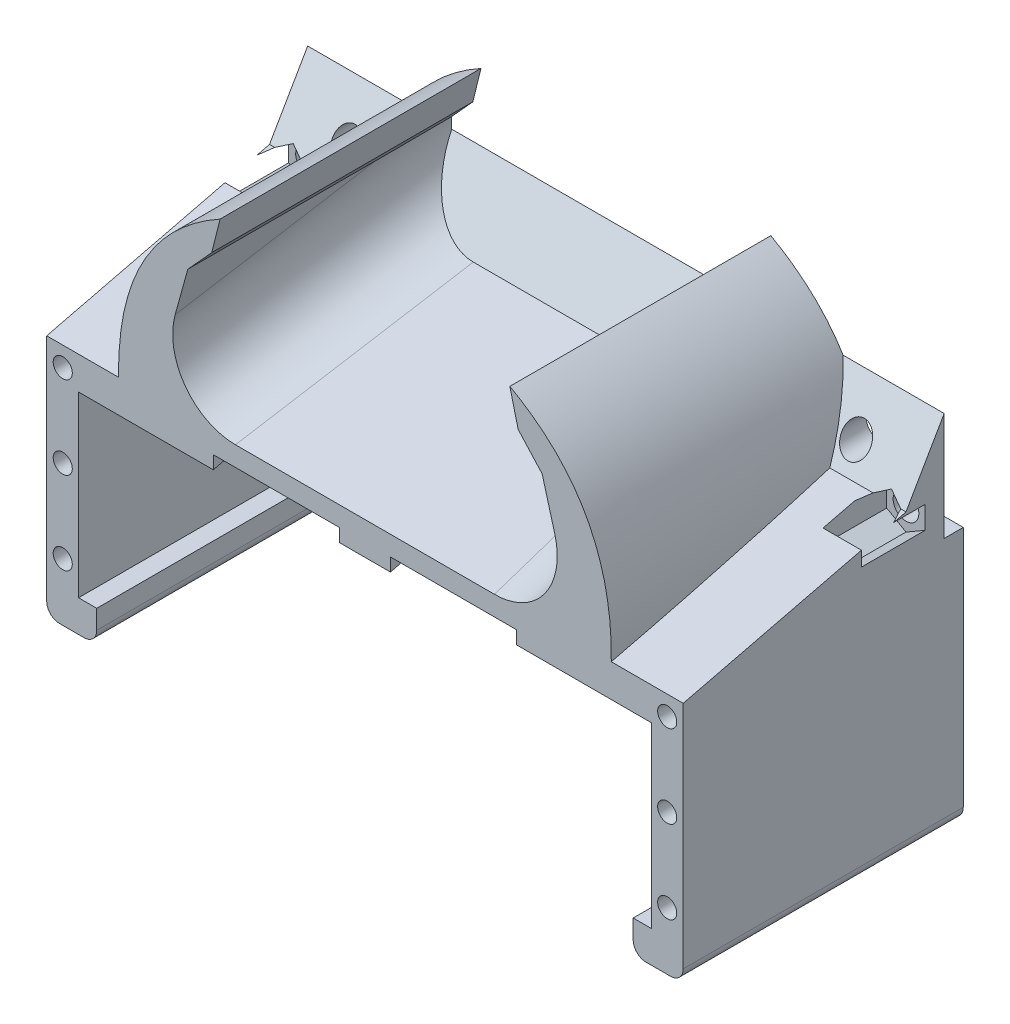
from build123d import *

# Parameters (mm, degrees)
SALIENTE_EXTRUIR1_DEPTH = 46
CROQUIS3_W              = 5
CROQUIS3_H              = 17
CORTAR_EXTRUIR1_DEPTH   = 107
VACIADO1_T              = -5
CORTAR_EXTRUIR3_DEPTH   = 5
CROQUIS8_W              = 84.286700134
CROQUIS8_H              = 59.012293191
CORTAR_EXTRUIR6_DEPTH   = 50
CROQUIS9_W              = 89.93795334
CROQUIS9_H              = 8.49113686
CORTAR_EXTRUIR7_DEPTH   = 10
REDONDEO1_R             = 2
REDONDEO2_R             = 2
REDONDEO3_R             = 2
CROQUIS10_W             = 19.827227688
CROQUIS10_H             = 42.140696998
CORTAR_EXTRUIR8_DEPTH   = 2
CROQUIS11_R             = 2.017504942
CROQUIS11_R_2           = 1.891140859
CORTAR_EXTRUIR9_DEPTH   = 9
CROQUIS12_R             = 2.25
CORTAR_EXTRUIR10_DEPTH  = 33
CORTAR_EXTRUIR11_START  = -3
CROQUIS13_R             = 2.075
CORTAR_EXTRUIR11_DEPTH  = 7
CROQUIS15_W             = 7.96749323
CROQUIS15_H             = 3.005999516
SALIENTE_EXTRUIR2_DEPTH = 10
CROQUIS16_R             = 1.5
CORTAR_EXTRUIR13_DEPTH  = 73
CROQUIS17_W             = 124.159046256
CROQUIS17_H             = 73.830112024
CORTAR_EXTRUIR14_DEPTH  = 2
CORTAR_EXTRUIR15_DEPTH  = 10
SALIENTE_EXTRUIR3_DEPTH = 41
REDONDEO4_R             = 10


with BuildPart() as part:
    # Croquis1 → Saliente-Extruir1 (new body)
    with BuildSketch(Plane.XY):
        Polygon((-50, -27.25), (-50, -29.825247619), (50, -29.825247619), (50, -27.25), (50, 27.25), (-50, 27.25), align=None)
    extrude(amount=SALIENTE_EXTRUIR1_DEPTH)

    # Croquis3 → Cortar-Extruir1 (cut)
    with BuildSketch(Plane.ZY.offset(50)):
        Polygon((46, 27.25), (5, 27.25), (11, 16.857695155), (46, 8.318575661), align=None)
        with Locations((2.5, 18.75)):
            Rectangle(CROQUIS3_W, CROQUIS3_H)
    extrude(amount=-CORTAR_EXTRUIR1_DEPTH, mode=Mode.SUBTRACT)

    # Vaciado1
    vaciado1_openings = [part.faces().sort_by_distance(p)[0] for p in [
        (0, -10.753335979, 46),
    ]]
    offset(amount=VACIADO1_T, openings=vaciado1_openings, kind=Kind.INTERSECTION)

    # Croquis5 → Cortar-Extruir3 (cut)
    with BuildSketch(Plane(origin=(0, 0, 0), x_dir=(-1, 0, 0), z_dir=(0, 0, -1))):
        Polygon((-44.96897667, 22.941518711), (-44.96897667, -22.941518711), (-44.96897667, -34.965963837), (44.96897667, -34.965963837), (44.96897667, -22.941518711), (44.96897667, 22.941518711), align=None)
    extrude(amount=-CORTAR_EXTRUIR3_DEPTH, mode=Mode.SUBTRACT)

    # Croquis8 → Cortar-Extruir6 (cut)
    with BuildSketch(Plane(origin=(0, 0, 2), x_dir=(-1, 0, 0), z_dir=(0, 0, -1))):
        with Locations((0, -42.853406707)):
            Rectangle(CROQUIS8_W, CROQUIS8_H)
    extrude(amount=-CORTAR_EXTRUIR6_DEPTH, mode=Mode.SUBTRACT)

    # Croquis9 → Cortar-Extruir7 (cut)
    with BuildSketch(Plane(origin=(0, 0, 5), x_dir=(-1, 0, 0), z_dir=(0, 0, -1))):
        with Locations((0, 9.49556843)):
            Rectangle(CROQUIS9_W, CROQUIS9_H)
    extrude(amount=-CORTAR_EXTRUIR7_DEPTH, mode=Mode.SUBTRACT)

    # Redondeo1
    redondeo1_edges = [part.edges().sort_by_distance(p)[0] for p in [
        (42.143350067, -29.825247619, 25.5),
        (-50, -29.825247619, 23),
    ]]
    fillet(redondeo1_edges, radius=REDONDEO1_R)

    # Redondeo2
    redondeo2_edges = [part.edges().sort_by_distance(p)[0] for p in [
        (50, -29.825247619, 23),
    ]]
    fillet(redondeo2_edges, radius=REDONDEO2_R)

    # Redondeo3
    redondeo3_edges = [part.edges().sort_by_distance(p)[0] for p in [
        (-42.143350067, -29.825247619, 25.5),
    ]]
    fillet(redondeo3_edges, radius=REDONDEO3_R)

    # Croquis10 → Cortar-Extruir8 (cut)
    with BuildSketch(Plane(origin=(0, 13.586066701, 3.314658486), x_dir=(1, 0, 0), z_dir=(0, -0.9715041436001179, -0.237022570587279))):
        with Locations((13.913613844, 22.867026133)):
            Rectangle(CROQUIS10_W, CROQUIS10_H)
        with Locations((-13.913613844, 22.867026133)):
            Rectangle(CROQUIS10_W, CROQUIS10_H)
    extrude(amount=-CORTAR_EXTRUIR8_DEPTH, mode=Mode.SUBTRACT)

    # Croquis11 → Cortar-Extruir9 (cut)
    with BuildSketch(Plane(origin=(0, 0, 0), x_dir=(-1, 0, 0), z_dir=(0, 0, -1))):
        with Locations((-47, 14.614370501)):
            Circle(CROQUIS11_R)
        with Locations((47, 14.614370501)):
            Circle(CROQUIS11_R_2)
    extrude(amount=-CORTAR_EXTRUIR9_DEPTH, mode=Mode.SUBTRACT)

    # Croquis12 → Cortar-Extruir10 (cut)
    with BuildSketch(Plane(origin=(0, 0, 0), x_dir=(-1, 0, 0), z_dir=(0, 0, -1))):
        with Locations((40, 20.614370501)):
            Circle(CROQUIS12_R)
        with Locations((-40, 20.614370501)):
            Circle(CROQUIS12_R)
    extrude(amount=-CORTAR_EXTRUIR10_DEPTH, mode=Mode.SUBTRACT)

    # Croquis13 → Cortar-Extruir11 (cut)
    with BuildSketch(Plane(origin=(0, 0, 5), x_dir=(-1, 0, 0), z_dir=(0, 0, -1)).offset(CORTAR_EXTRUIR11_START)):
        with Locations((47, 14.614370501)):
            Circle(CROQUIS13_R)
        with Locations((-47, 14.614370501)):
            Circle(CROQUIS13_R)
    extrude(amount=-CORTAR_EXTRUIR11_DEPTH, mode=Mode.SUBTRACT)

    # Croquis15 → Saliente-Extruir2 (add)
    with BuildSketch(Plane(origin=(0, 0, 15), x_dir=(-1, 0, 0), z_dir=(0, 0, -1))):
        with Locations((-40.985230055, 12.238137102)):
            Rectangle(CROQUIS15_W, CROQUIS15_H)
        with Locations((40.985230055, 12.238137102)):
            Rectangle(CROQUIS15_W, CROQUIS15_H)
    extrude(amount=SALIENTE_EXTRUIR2_DEPTH)

    # Croquis16 → Cortar-Extruir13 (cut)
    with BuildSketch(Plane(origin=(0, 0, 0), x_dir=(-1, 0, 0), z_dir=(0, 0, -1))):
        with Locations((-47.484488335, 5.25)):
            Circle(CROQUIS16_R)
        with Locations((-47.484488335, -20.75)):
            Circle(CROQUIS16_R)
        with Locations((-47.484488335, -7.75)):
            Circle(CROQUIS16_R)
        with Locations((47.484488335, -7.75)):
            Circle(CROQUIS16_R)
        with Locations((47.484488335, -20.75)):
            Circle(CROQUIS16_R)
        with Locations((47.484488335, 5.25)):
            Circle(CROQUIS16_R)
    extrude(amount=-CORTAR_EXTRUIR13_DEPTH, mode=Mode.SUBTRACT)

    # Croquis17 → Cortar-Extruir14 (cut)
    with BuildSketch(Plane(origin=(0, 0, 0), x_dir=(-1, 0, 0), z_dir=(0, 0, -1))):
        Rectangle(CROQUIS17_W, CROQUIS17_H)
    extrude(amount=-CORTAR_EXTRUIR14_DEPTH, mode=Mode.SUBTRACT)

    # Croquis19 → Cortar-Extruir15 (cut)
    with BuildSketch(Plane.XY.offset(8)):
        Polygon((47, 11.114370501), (50.031088913, 12.864370501), (50.031088913, 16.364370501), (47, 18.114370501), (43.968911087, 16.364370501), (43.968911087, 12.864370501), align=None)
        Polygon((-43.968911087, 12.864370501), (-47, 11.114370501), (-50.031088913, 12.864370501), (-50.031088913, 16.364370501), (-47, 18.114370501), (-43.968911087, 16.364370501), align=None)
    extrude(amount=CORTAR_EXTRUIR15_DEPTH, mode=Mode.SUBTRACT)

    # Croquis21 → Saliente-Extruir3 (add)
    with BuildSketch(Plane.XY.offset(46)):
        with BuildLine():
            Line((-22.763380433, 37.82435205), (-24.067061415, 32.609628124))
            Line((-24.067061415, 32.609628124), (-27.833250917, 28.463205933))
            Line((-27.833250917, 28.463205933), (-33.41481635, 8.318575661))
            Line((-33.41481635, 8.318575661), (-38.697259097, 8.318575661))
            add(Edge.make_bspline(
                [(-38.697259097, 8.318575661), (-39.050795871, 28.768789272), (-22.763380433, 37.82435205)],
                knots=[0, 0, 0, 1, 1, 1], degree=2))
        make_face()
        with BuildLine():
            Line((27.833250917, 28.463205933), (33.41481635, 8.318575661))
            Line((33.41481635, 8.318575661), (38.697259097, 8.318575661))
            add(Edge.make_bspline(
                [(38.697259097, 8.318575661), (39.050795871, 28.768789272), (22.763380433, 37.82435205)],
                knots=[0, 0, 0, 1, 1, 1], degree=2))
            Line((22.763380433, 37.82435205), (24.067061415, 32.609628124))
            Line((24.067061415, 32.609628124), (27.833250917, 28.463205933))
        make_face()
    extrude(amount=-SALIENTE_EXTRUIR3_DEPTH)

    # Redondeo4
    redondeo4_edges = [part.edges().sort_by_distance(p)[0] for p in [
        (-32.231829779, 12.588135408, 28.5),
        (32.231829779, 12.588135408, 28.5),
    ]]
    fillet(redondeo4_edges, radius=REDONDEO4_R)


solid = part.part
